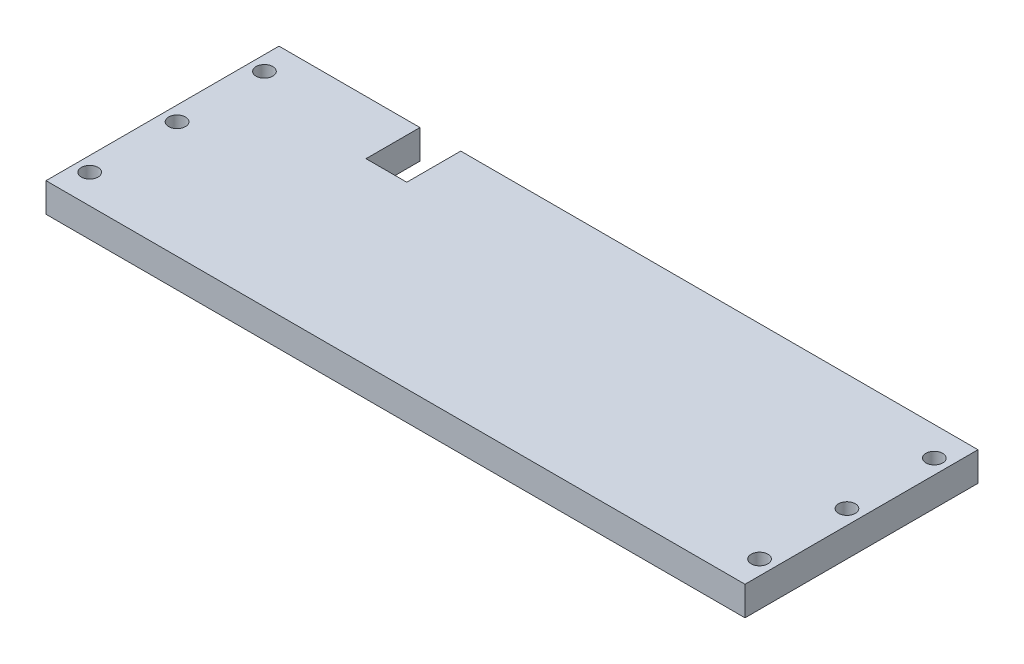
from build123d import *

# Parameters (mm, degrees)
SKETCH1_W           = 152.4
SKETCH1_H           = 50.8
BOSS_EXTRUDE1_DEPTH = 6.35
SKETCH2_R           = 1.8288
CUT_EXTRUDE1_DEPTH  = 6.35
SKETCH5_W           = 8.89
SKETCH5_H           = 11.765011578
CUT_EXTRUDE2_DEPTH  = 161.769159045


with BuildPart() as part:
    # Sketch1 → Boss-Extrude1 (new body)
    with BuildSketch(Plane(origin=(0, 0, 0), x_dir=(1, 0, 0), z_dir=(0, 1, 0))):
        with Locations((-76.2, 25.4)):
            Rectangle(SKETCH1_W, SKETCH1_H)
    extrude(amount=BOSS_EXTRUDE1_DEPTH)

    # Sketch2 → Cut-Extrude1 (cut)
    with BuildSketch(Plane(origin=(0, 6.35, 0), x_dir=(1, 0, 0), z_dir=(0, 1, 0))):
        with Locations(Location((-149.225, 44.45, 0), (0, 0, 270))):
            Circle(SKETCH2_R)
        with Locations(Location((-149.225, 25.4, 0), (0, 0, 270))):
            Circle(SKETCH2_R)
        with Locations(Location((-149.225, 6.35, 0), (0, 0, 270))):
            Circle(SKETCH2_R)
        with Locations(Location((-3.175, 25.4, 0), (0, 0, 270))):
            Circle(SKETCH2_R)
        with Locations(Location((-3.175, 44.45, 0), (0, 0, 270))):
            Circle(SKETCH2_R)
        with Locations(Location((-3.175, 6.35, 0), (0, 0, 270))):
            Circle(SKETCH2_R)
    extrude(amount=-CUT_EXTRUDE1_DEPTH, mode=Mode.SUBTRACT)

    # Sketch5 → Cut-Extrude2 (cut, through all)
    with BuildSketch(Plane(origin=(0, 6.35, 0), x_dir=(1, 0, 0), z_dir=(0, 1, 0))):
        with Locations((-117.221, 44.917494211)):
            Rectangle(SKETCH5_W, SKETCH5_H)
    extrude(amount=-CUT_EXTRUDE2_DEPTH, mode=Mode.SUBTRACT)


solid = part.part
